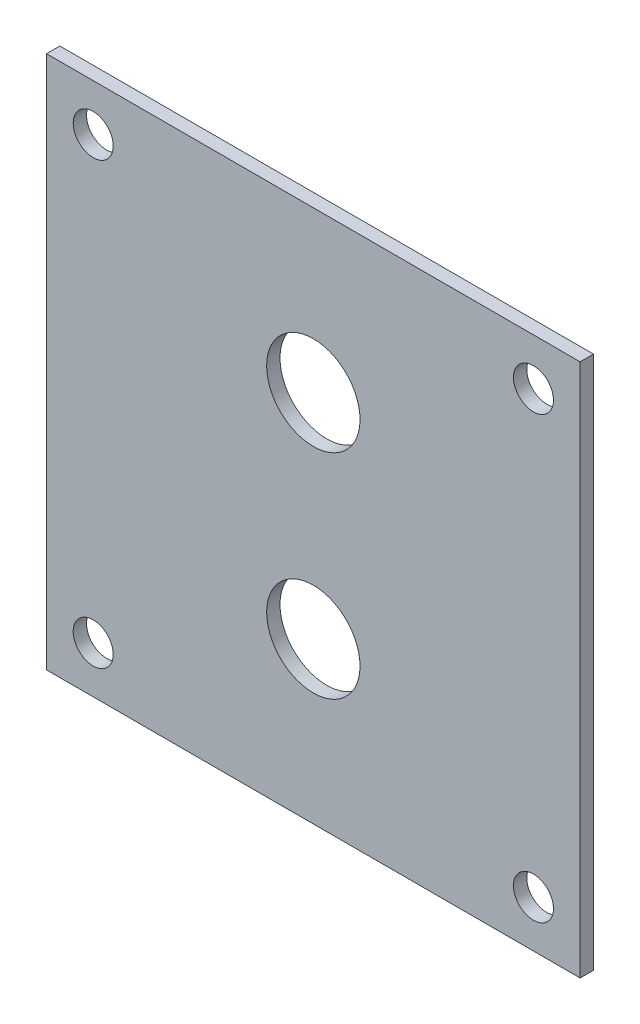
from build123d import *

# Parameters (mm, degrees)
SKETCH1_W           = 127
SKETCH1_H           = 127
BOSS_EXTRUDE1_DEPTH = 3.175
SKETCH2_R           = 11.1125
CUT_EXTRUDE1_DEPTH  = 3.175
SKETCH4_R           = 4.7625
CUT_EXTRUDE3_DEPTH  = 3.175


with BuildPart() as part:
    # Sketch1 → Boss-Extrude1 (new body)
    with BuildSketch(Plane.XY):
        Rectangle(SKETCH1_W, SKETCH1_H)
    extrude(amount=BOSS_EXTRUDE1_DEPTH)

    # Sketch2 → Cut-Extrude1 (cut)
    with BuildSketch(Plane(origin=(0, 0, 0), x_dir=(-1, 0, 0), z_dir=(0, 0, -1))):
        with Locations((0, 25.4)):
            Circle(SKETCH2_R)
        with Locations((0, -25.4)):
            Circle(SKETCH2_R)
    extrude(amount=-CUT_EXTRUDE1_DEPTH, mode=Mode.SUBTRACT)

    # Sketch4 → Cut-Extrude3 (cut)
    with BuildSketch(Plane(origin=(0, 0, 0), x_dir=(-1, 0, 0), z_dir=(0, 0, -1))):
        with Locations((52.3875, 52.3875)):
            Circle(SKETCH4_R)
        with Locations(Location((52.3875, -52.3875, 0), (0, 0, 180))):
            Circle(SKETCH4_R)
        with Locations(Location((-52.3875, 52.3875, 0), (0, 0, 180))):
            Circle(SKETCH4_R)
        with Locations((-52.3875, -52.3875)):
            Circle(SKETCH4_R)
    extrude(amount=-CUT_EXTRUDE3_DEPTH, mode=Mode.SUBTRACT)


solid = part.part
